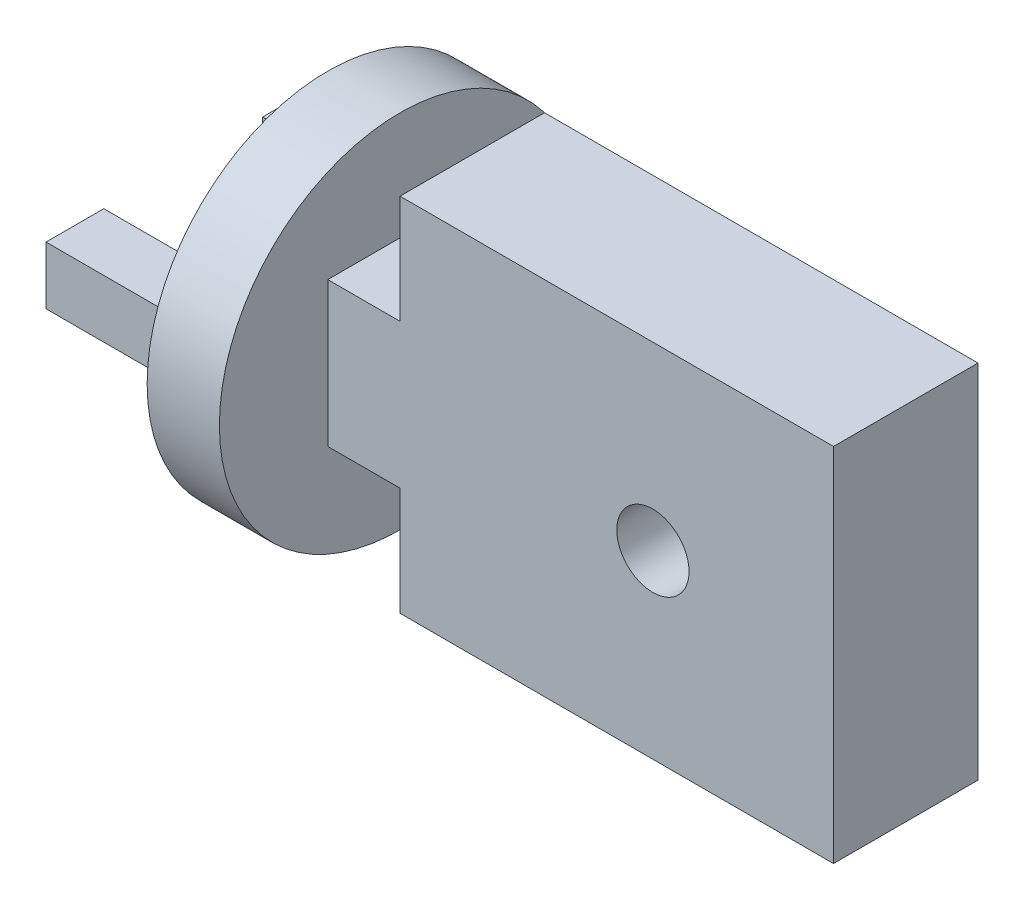
from build123d import *

# Parameters (mm, degrees)
SKETCH1_W           = 152.4
SKETCH1_H           = 127
BOSS_EXTRUDE1_DEPTH = 127
SKETCH2_W           = 50.8
SKETCH2_H           = 50.8
BOSS_EXTRUDE2_DEPTH = 25.4
SKETCH3_R           = 63.5
BOSS_EXTRUDE3_DEPTH = 25.4
SKETCH4_W           = 20.32
SKETCH4_H           = 20.32
BOSS_EXTRUDE4_DEPTH = 50.8
SKETCH5_W           = 152.4
SKETCH5_H           = 38.1
CUT_EXTRUDE1_DEPTH  = 253.726809025
SKETCH6_R           = 12.7
CUT_EXTRUDE2_DEPTH  = 209.682294409


with BuildPart() as part:
    # Sketch1 → Boss-Extrude1 (new body)
    with BuildSketch(Plane.XY):
        Rectangle(SKETCH1_W, SKETCH1_H)
    extrude(amount=BOSS_EXTRUDE1_DEPTH)

    # Sketch2 → Boss-Extrude2 (add)
    with BuildSketch(Plane.ZY.offset(76.2)):
        with Locations((63.5, 0)):
            Rectangle(SKETCH2_W, SKETCH2_H)
    extrude(amount=BOSS_EXTRUDE2_DEPTH)

    # Sketch3 → Boss-Extrude3 (add)
    with BuildSketch(Plane.ZY.offset(101.6)):
        with Locations((63.5, 0)):
            Circle(SKETCH3_R)
    extrude(amount=BOSS_EXTRUDE3_DEPTH)

    # Sketch4 → Boss-Extrude4 (add)
    with BuildSketch(Plane.ZY.offset(127)):
        with Locations((25.4, 0)):
            Rectangle(SKETCH4_W, SKETCH4_H)
        with Locations((101.6, 0)):
            Rectangle(SKETCH4_W, SKETCH4_H)
    extrude(amount=BOSS_EXTRUDE4_DEPTH)

    # Sketch5 → Cut-Extrude1 (cut, through all)
    with BuildSketch(Plane(origin=(0, 63.5, 0), x_dir=(1, 0, 0), z_dir=(0, 1, 0))):
        with Locations((0, -107.95)):
            Rectangle(SKETCH5_W, SKETCH5_H)
        with Locations((0, -19.05)):
            Rectangle(SKETCH5_W, SKETCH5_H)
    extrude(amount=-CUT_EXTRUDE1_DEPTH, mode=Mode.SUBTRACT)

    # Sketch6 → Cut-Extrude2 (cut, through all)
    with BuildSketch(Plane.XY.offset(88.9)):
        with Locations((12.7, 0)):
            Circle(SKETCH6_R)
    extrude(amount=-CUT_EXTRUDE2_DEPTH, mode=Mode.SUBTRACT)


solid = part.part
